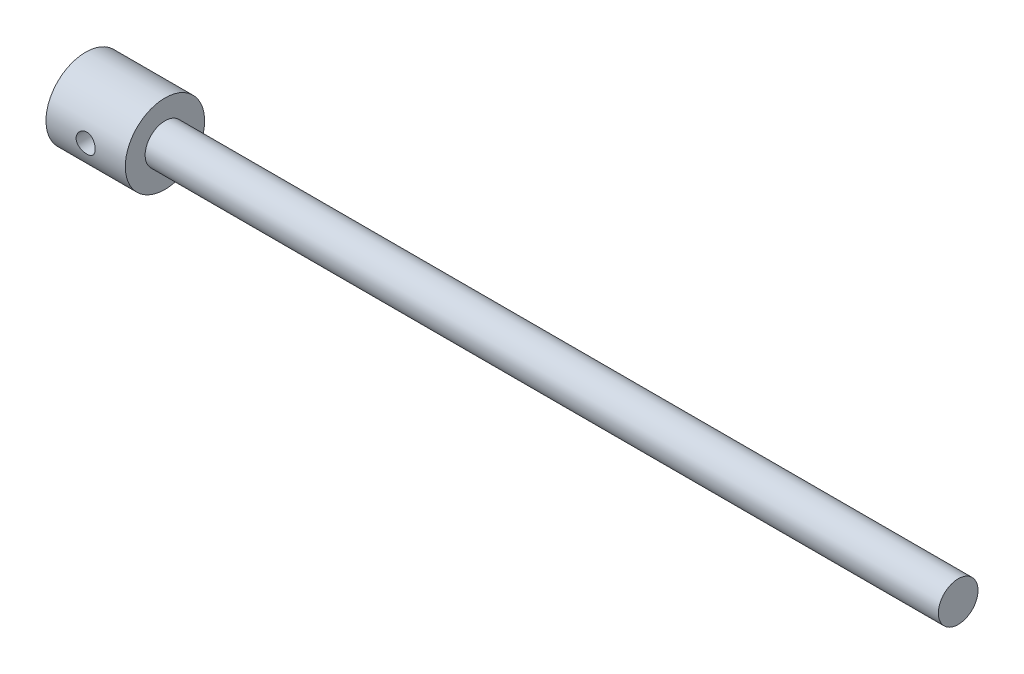
from build123d import *

# Parameters (mm, degrees)
CUT_EXTRUDE1_DEPTH      = 552.135192126
CUT_EXTRUDE1_DEPTH_BACK = 552.135192126
SKETCH2_R               = 6


with BuildPart() as part:
    # Sketch1 → Revolve1 (revolve)
    with BuildSketch(Plane.XY):
        Polygon((0, 0), (0, 25), (50, 25), (50, 12.5), (550, 12.5), (550, 0), align=None)
    revolve(axis=Axis((550, 0, 0), (-1, 0, 0)))

    # Sketch2 → Cut-Extrude1 (cut, two sides: drawn at the far end of the back side and taken through both)
    with BuildSketch(Plane.XY.offset(-CUT_EXTRUDE1_DEPTH_BACK)):
        with Locations((25, 0)):
            Circle(SKETCH2_R)
    extrude(amount=CUT_EXTRUDE1_DEPTH + CUT_EXTRUDE1_DEPTH_BACK, mode=Mode.SUBTRACT)


solid = part.part
